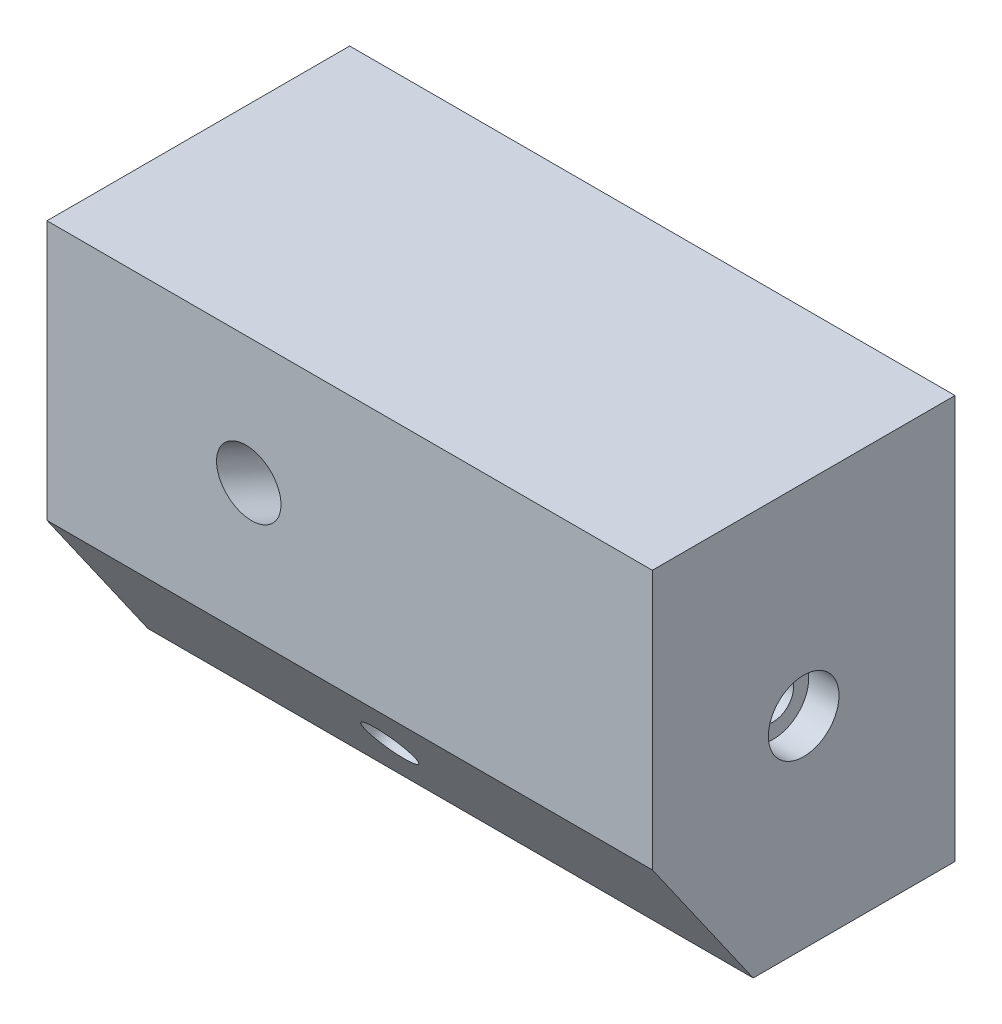
from build123d import *

# Parameters (mm, degrees)
SKETCH_1_W          = 120
SKETCH_1_H          = 80
EXTRUDE_1_DEPTH     = 60
CUT_EXTRUDE_1_DEPTH = 157.204993518
SWEEP_2_PROFILE_R   = 6
CUT_EXTRUDE_2_DEPTH = 3.602159411
CUT_EXTRUDE_2_DRAFT = -59
SWEEP_4_PROFILE_R   = 5
SKETCH_6_R          = 7
CUT_EXTRUDE_3_DEPTH = 6
SKETCH_7_R          = 4
CUT_EXTRUDE_4_DEPTH = 50


with BuildPart() as part:
    # 草图1 → 凸台-拉伸1 (new body)
    with BuildSketch(Plane.XY):
        with Locations((60, 40)):
            Rectangle(SKETCH_1_W, SKETCH_1_H)
    extrude(amount=EXTRUDE_1_DEPTH)

    # 草图2 → 切除-拉伸1 (cut, through all)
    with BuildSketch(Plane(origin=(0, 0, 0), x_dir=(0, 0, -1), z_dir=(1, 0, 0))):
        Polygon((-40, 0), (-62, 0), (-62, 31.4192), align=None)
    extrude(amount=CUT_EXTRUDE_1_DEPTH, mode=Mode.SUBTRACT)

    # 切除-扫描2: sweep along a curve in space
    with BuildLine() as sweep_2_path:
        Line((36.683319, 57.441689, 69.112507), (58.926443, 41.066649, 8.000026))
    # 切除-扫描2 profile (on start of the path) → 切除-扫描2 (sweep, cut)
    with BuildSketch(Plane(origin=(36.683319, 57.441689, 69.112507), x_dir=(-0.9396926209151826, 0, -0.34202014297049077), z_dir=(0.3316681247446686, -0.24416888605300846, -0.9112506845605045))):
        Circle(SWEEP_2_PROFILE_R)
    sweep(path=sweep_2_path.line, mode=Mode.SUBTRACT)


with BuildPart() as cut_extrude_2_tool:
    # 草图4 → 切除-拉伸2 (with draft: the straight prism first)
    with BuildSketch(Plane(origin=(0.738557167, -0.543714235, -2.029169141), x_dir=(0.9433961283725703, 0.08584202767282707, 0.3203668073578514), z_dir=(-0.3316681247446686, 0.2441688860530088, 0.9112506845605044))):
        with BuildLine():
            ThreePointArc((61.679165391, 31.596777759), (67.679165393, 37.596777757), (61.679165395, 43.596777759))
            ThreePointArc((61.679165395, 43.596777759), (55.679165393, 37.596777761), (61.679165391, 31.596777759))
        make_face()
    extrude(amount=-CUT_EXTRUDE_2_DEPTH)
    # 切除-拉伸2: the draft: its side faces are tilted about the plane it starts from
    cut_extrude_2_sides = [cut_extrude_2_tool.faces().sort_by_distance(p)[0] for p in [
        (59.523803726, 34.831326418, 7.911705161),
    ]]
    draft(cut_extrude_2_sides, Plane(origin=(0.738557167, -0.543714235, -2.029169141), x_dir=(0.9433961283725703, 0.08584202767282707, 0.3203668073578514), z_dir=(-0.3316681247446686, 0.2441688860530088, 0.9112506845605044)), CUT_EXTRUDE_2_DRAFT)


with BuildPart() as part_1:
    add(part.part)

    # 切除-拉伸2: cut by cut_extrude_2_tool
    add(cut_extrude_2_tool.part, mode=Mode.SUBTRACT)

    # 切除-扫描4: sweep along a curve in space
    with BuildLine() as sweep_4_path:
        Line((57.9402, 9.692889, 56.553216), (57.9402, 41.792635, 10.710028))
    # 切除-扫描4 profile (on start of the path) → 切除-扫描4 (sweep, cut)
    with BuildSketch(Plane(origin=(57.9402, 9.692889, 56.553216), x_dir=(0, -0.8191520427204216, -0.5735764385911964), z_dir=(0, 0.5735764385911964, -0.8191520427204216))):
        Circle(SWEEP_4_PROFILE_R)
    sweep(path=sweep_4_path.line, mode=Mode.SUBTRACT)

    # 草图6 → 切除-拉伸3 (cut)
    with BuildSketch(Plane(origin=(120, 0, 0), x_dir=(0, 0, -1), z_dir=(1, 0, 0))):
        with Locations((-30, 40)):
            Circle(SKETCH_6_R)
    extrude(amount=-CUT_EXTRUDE_3_DEPTH, mode=Mode.SUBTRACT)

    # 草图7 → 切除-拉伸4 (cut)
    with BuildSketch(Plane(origin=(120, 0, 0), x_dir=(0, 0, -1), z_dir=(1, 0, 0))):
        with Locations((-30, 40)):
            Circle(SKETCH_7_R)
    extrude(amount=-CUT_EXTRUDE_4_DEPTH, mode=Mode.SUBTRACT)


solid = part_1.part
